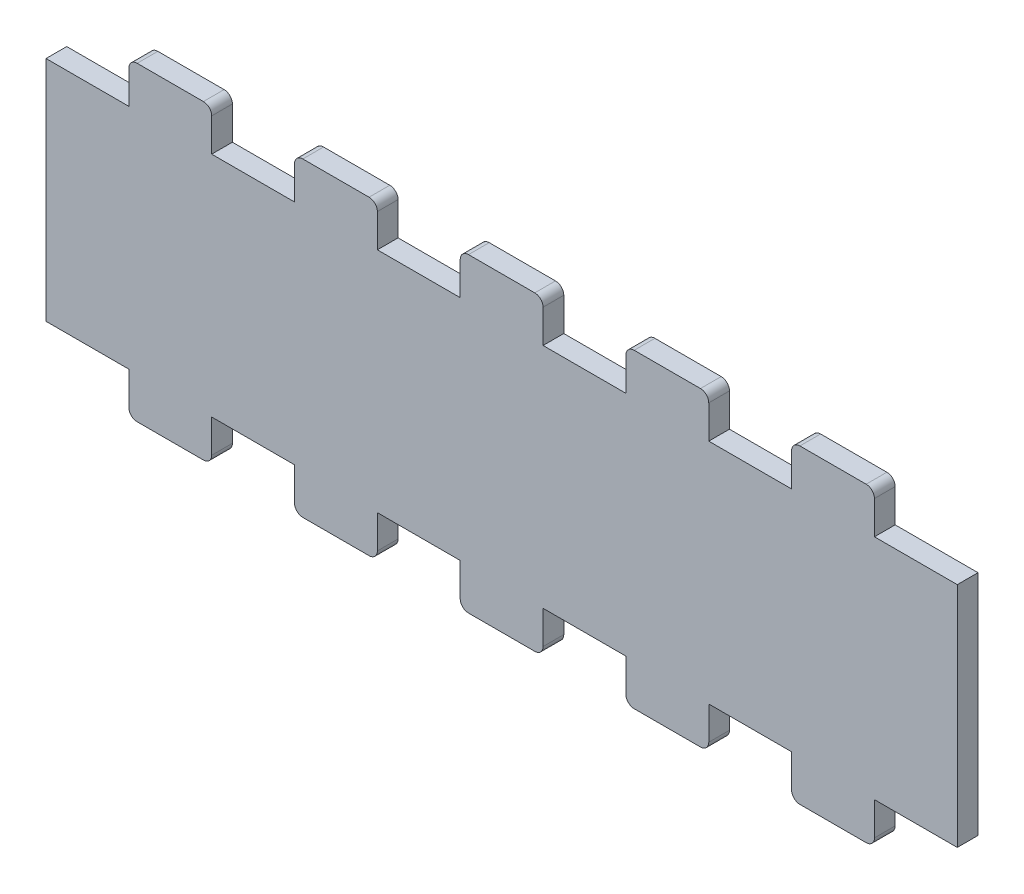
from build123d import *

# Parameters (mm, degrees)
SKETCH1_W            = 220
SKETCH1_H            = 54.95
BOSS_EXTRUDE1_DEPTH  = 5
SKETCH2_W            = 20
SKETCH2_H            = 10
BOSS_EXTRUDE2_DEPTH  = 5
FILLET1_R            = 2
FILLET1_OF_MIRROR1_R = 2


with BuildPart() as part:
    # Sketch1 → Boss-Extrude1 (new body)
    with BuildSketch(Plane.XY):
        with Locations((110, 27.475)):
            Rectangle(SKETCH1_W, SKETCH1_H)
    extrude(amount=BOSS_EXTRUDE1_DEPTH)

    # Sketch2 → Boss-Extrude2 (add)
    with BuildSketch(Plane.XY.offset(5)):
        with Locations((30, 59.95)):
            Rectangle(SKETCH2_W, SKETCH2_H)
        with Locations((70, 59.95)):
            Rectangle(SKETCH2_W, SKETCH2_H)
        with Locations((110, 59.95)):
            Rectangle(SKETCH2_W, SKETCH2_H)
        with Locations((150, 59.95)):
            Rectangle(SKETCH2_W, SKETCH2_H)
        with Locations((190, 59.95)):
            Rectangle(SKETCH2_W, SKETCH2_H)
    boss_extrude2 = extrude(amount=-BOSS_EXTRUDE2_DEPTH)

    # Fillet1
    fillet1_edges = [part.edges().sort_by_distance(p)[0] for p in [
        (40, 64.95, 2.5),
        (20, 64.95, 2.5),
        (80, 64.95, 2.5),
        (60, 64.95, 2.5),
        (120, 64.95, 2.5),
        (100, 64.95, 2.5),
        (160, 64.95, 2.5),
        (140, 64.95, 2.5),
        (200, 64.95, 2.5),
        (180, 64.95, 2.5),
    ]]
    fillet(fillet1_edges, radius=FILLET1_R)

    # Mirror1: Boss-Extrude2 across plane
    add(boss_extrude2.mirror(Plane.ZX.offset(27.475)))

    # Fillet1 of Mirror1
    fillet1_of_mirror1_edges = [part.edges().sort_by_distance(p)[0] for p in [
        (40, -10, 2.5),
        (20, -10, 2.5),
        (80, -10, 2.5),
        (60, -10, 2.5),
        (120, -10, 2.5),
        (100, -10, 2.5),
        (160, -10, 2.5),
        (140, -10, 2.5),
        (200, -10, 2.5),
        (180, -10, 2.5),
    ]]
    fillet(fillet1_of_mirror1_edges, radius=FILLET1_OF_MIRROR1_R)


solid = part.part
